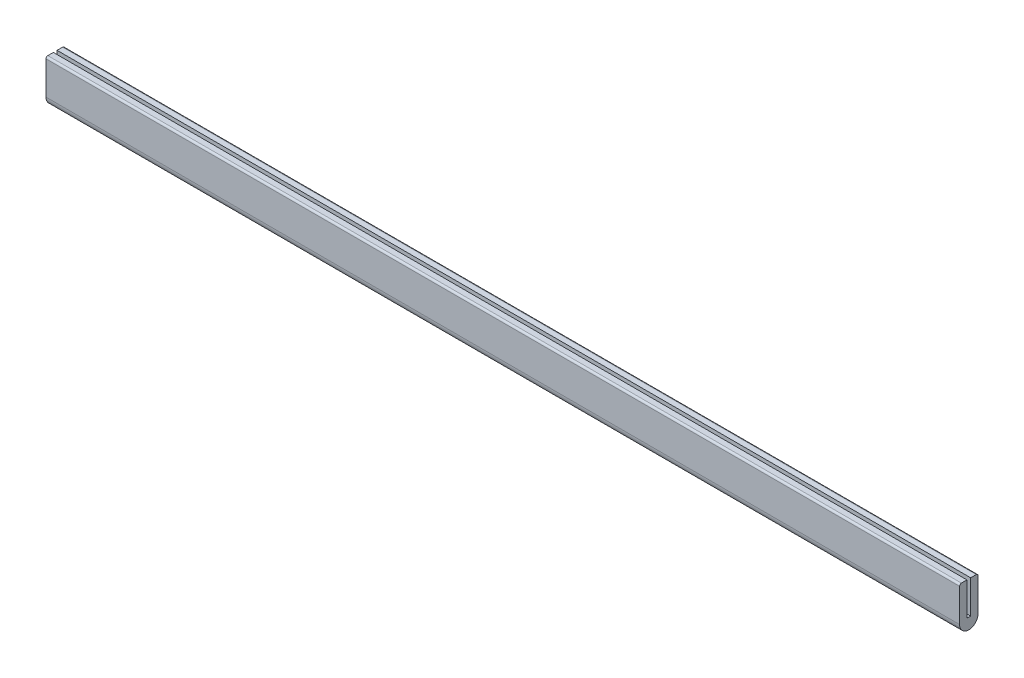
from build123d import *

# Parameters (mm, degrees)
BOSS_EXTRUDE1_DEPTH = 393.7
FILLET1_R           = 1.5875


with BuildPart() as part:
    # Sketch1 → Boss-Extrude1 (new, symmetric)
    with BuildSketch(Plane(origin=(0, 0, 0), x_dir=(0, 0, -1), z_dir=(1, 0, 0))):
        with BuildLine():
            Line((-1.5875, 28.575), (-7.9375, 28.575))
            Line((-7.9375, 28.575), (-7.9375, -1.5875))
            ThreePointArc((-7.9375, -1.5875), (0, -9.525), (7.9375, -1.5875))
            Line((7.9375, -1.5875), (7.9375, 28.575))
            Line((7.9375, 28.575), (1.5875, 28.575))
            Line((1.5875, 28.575), (1.5875, 0))
            Line((1.5875, 0), (-1.5875, 0))
            Line((-1.5875, 0), (-1.5875, 28.575))
        make_face()
    extrude(amount=BOSS_EXTRUDE1_DEPTH, both=True)

    # Fillet1
    fillet1_edges = [part.edges().sort_by_distance(p)[0] for p in [
        (0, 28.575, -7.9375),
        (0, 28.575, 7.9375),
    ]]
    fillet(fillet1_edges, radius=FILLET1_R)


solid = part.part
